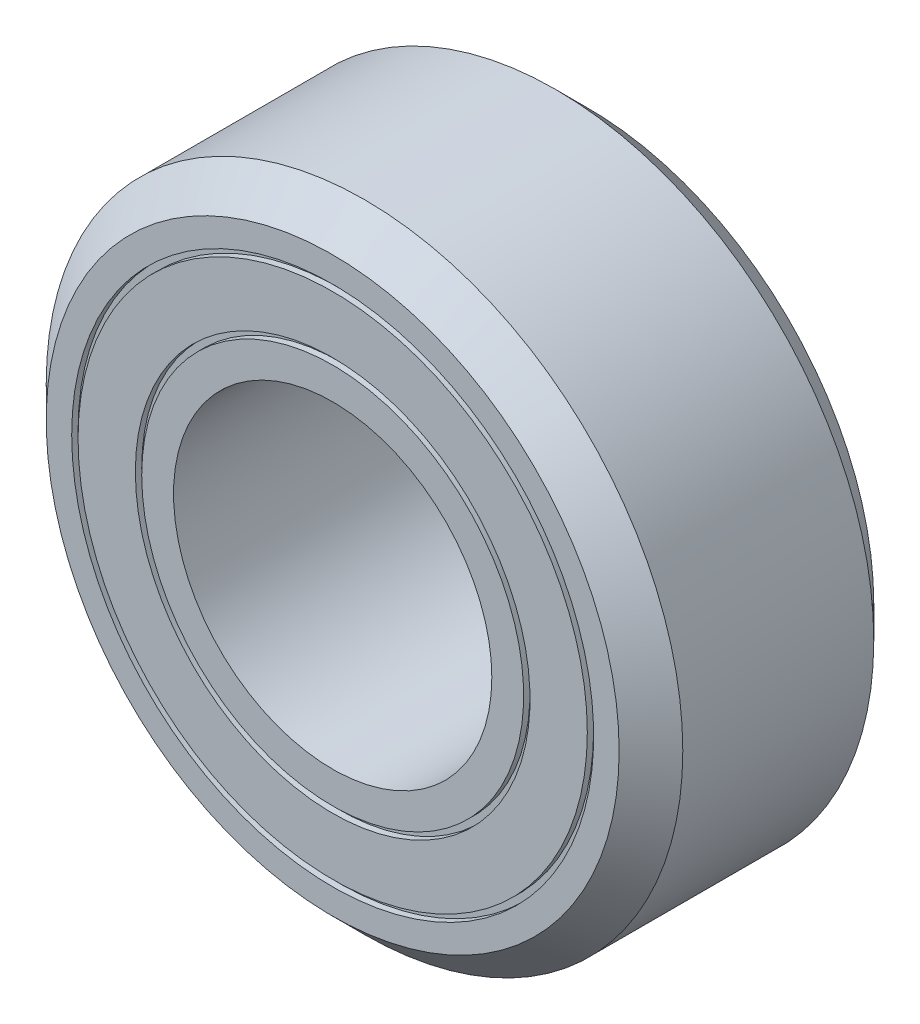
from build123d import *

# Parameters (mm, degrees)
SKETCH1_R           = 5
SKETCH1_R_2         = 2.5
BOSS_EXTRUDE1_DEPTH = 4
CHAMFER1_SIZE       = 0.5
SKETCH2_R           = 4.1
SKETCH2_R_2         = 4
SKETCH2_R_3         = 3.1
SKETCH2_R_4         = 3
CUT_EXTRUDE1_DEPTH  = 0.1


with BuildPart() as part:
    # Sketch1 → Boss-Extrude1 (new body)
    with BuildSketch(Plane.XY):
        Circle(SKETCH1_R)
        Circle(SKETCH1_R_2, mode=Mode.SUBTRACT)
    extrude(amount=BOSS_EXTRUDE1_DEPTH)

    # Chamfer1
    chamfer1_edges = [part.edges().sort_by_distance(p)[0] for p in [
        (-5, 0, 0),
        (-5, 0, 4),
    ]]
    chamfer(chamfer1_edges, length=CHAMFER1_SIZE)

    # Sketch2 → Cut-Extrude1 (cut)
    # profile 1 of 2: a face of its own
    with BuildSketch(Plane(origin=(0, 0, 0), x_dir=(-1, 0, 0), z_dir=(0, 0, -1))):
        Circle(SKETCH2_R)
        Circle(SKETCH2_R_2, mode=Mode.SUBTRACT)
    # profile 2 of 2: a face of its own
    with BuildSketch(Plane(origin=(0, 0, 0), x_dir=(-1, 0, 0), z_dir=(0, 0, -1))):
        Circle(SKETCH2_R_3)
        Circle(SKETCH2_R_4, mode=Mode.SUBTRACT)
    cut_extrude1 = extrude(amount=-CUT_EXTRUDE1_DEPTH, mode=Mode.SUBTRACT)

    # Mirror1: Cut-Extrude1 across plane
    add(cut_extrude1.mirror(Plane(origin=(0, 0, 2), x_dir=(1, 0, 0), z_dir=(0, 0, -1))), mode=Mode.SUBTRACT)


solid = part.part
